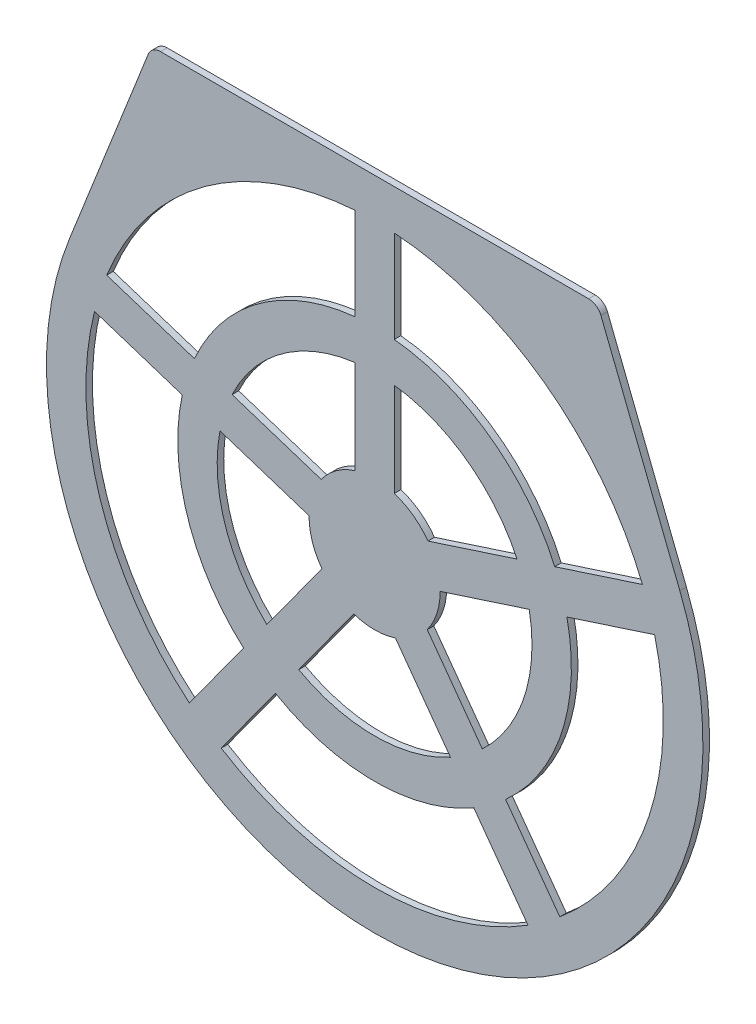
from build123d import *

# Parameters (mm, degrees)
BOSS_EXTRUDE1_DEPTH = 5


with BuildPart() as part:
    # Sketch1 → Boss-Extrude1 (new body)
    with BuildSketch(Plane.XY):
        with BuildLine():
            Line((-232.377693895, 91.946298682), (-172.366969932, 243.677851947))
            ThreePointArc((-172.366969932, 243.677851947), (-168.690205127, 248.269779909), (-163.067862176, 250))
            Line((-163.067862176, 250), (-0.1, 250))
            Line((-0.1, 250), (163.075862176, 250))
            ThreePointArc((163.075862176, 250), (168.693678089, 248.272855877), (172.370938455, 243.688028873))
            Line((172.370938455, 243.688028873), (232.476906979, 92.200721814))
            ThreePointArc((232.476906979, 92.200721814), (0.236829395, -249.999962555), (-232.377693895, 91.946298682))
        make_face()
        with BuildLine():
            Line((15.838692049, -47.319613631), (57.786513592, -105.055836805))
            ThreePointArc((57.786513592, -105.055836805), (0, -119.9), (-57.786513592, -105.055836805))
            Line((-57.786513592, -105.055836805), (-15.838692049, -47.319613631))
            ThreePointArc((-15.838692049, -47.319613631), (0, -49.9), (15.838692049, -47.319613631))
        make_face(mode=Mode.SUBTRACT)
        with BuildLine():
            Line((-40.10920188, -29.686056062), (-82.057023423, -87.422279237))
            ThreePointArc((-82.057023423, -87.422279237), (-114.031676304, -37.051137626), (-117.771052914, 22.494201374))
            Line((-117.771052914, 22.494201374), (-49.898051904, 0.440926504))
            ThreePointArc((-49.898051904, 0.440926504), (-47.457720163, -15.419948019), (-40.10920188, -29.686056062))
        make_face(mode=Mode.SUBTRACT)
        with BuildLine():
            Line((40.10920188, -29.686056062), (82.057023423, -87.422279237))
            ThreePointArc((82.057023423, -87.422279237), (114.031676304, -37.051137626), (117.771052914, 22.494201374))
            Line((117.771052914, 22.494201374), (49.898051904, 0.440926504))
            ThreePointArc((49.898051904, 0.440926504), (47.457720163, -15.419948019), (40.10920188, -29.686056062))
        make_face(mode=Mode.SUBTRACT)
        with BuildLine():
            Line((-137.21255284, 60.354994352), (-204.01494883, 82.060408564))
            ThreePointArc((-204.01494883, 82.060408564), (-129.253976979, 177.902837063), (-15, 219.387807318))
            Line((-15, 219.387807318), (-15, 149.147611446))
            ThreePointArc((-15, 149.147611446), (-88.109009319, 121.271647457), (-137.21255284, 60.354994352))
        make_face(mode=Mode.SUBTRACT)
        with BuildLine():
            Line((-146.483062671, 31.823298863), (-213.285458662, 53.528713076))
            ThreePointArc((-213.285458662, 53.528713076), (-209.137327933, -67.952837063), (-141.08817259, -168.671685695))
            Line((-141.08817259, -168.671685695), (-99.802021338, -111.846173546))
            ThreePointArc((-99.802021338, -111.846173546), (-142.563371793, -46.321647457), (-146.483062671, 31.823298863))
        make_face(mode=Mode.SUBTRACT)
        with BuildLine():
            Line((-75.531511507, -129.479731115), (-116.817662759, -186.305243264))
            ThreePointArc((-116.817662759, -186.305243264), (0, -219.9), (116.817662759, -186.305243264))
            Line((116.817662759, -186.305243264), (75.531511507, -129.479731115))
            ThreePointArc((75.531511507, -129.479731115), (0, -149.9), (-75.531511507, -129.479731115))
        make_face(mode=Mode.SUBTRACT)
        with BuildLine():
            Line((99.802021338, -111.846173546), (141.08817259, -168.671685695))
            ThreePointArc((141.08817259, -168.671685695), (209.137327933, -67.952837063), (213.285458662, 53.528713076))
            Line((213.285458662, 53.528713076), (146.483062671, 31.823298863))
            ThreePointArc((146.483062671, 31.823298863), (142.563371793, -46.321647457), (99.802021338, -111.846173546))
        make_face(mode=Mode.SUBTRACT)
        with BuildLine():
            Line((137.21255284, 60.354994352), (204.01494883, 82.060408564))
            ThreePointArc((204.01494883, 82.060408564), (129.253976979, 177.902837063), (15, 219.387807318))
            Line((15, 219.387807318), (15, 149.147611446))
            ThreePointArc((15, 149.147611446), (88.109009319, 121.271647457), (137.21255284, 60.354994352))
        make_face(mode=Mode.SUBTRACT)
        with BuildLine():
            Line((15, 47.592121197), (15, 118.958017805))
            ThreePointArc((15, 118.958017805), (70.47545175, 97.001137626), (108.500543083, 51.025896863))
            Line((108.500543083, 51.025896863), (40.627542073, 28.972621993))
            ThreePointArc((40.627542073, 28.972621993), (29.330484089, 40.369948019), (15, 47.592121197))
        make_face(mode=Mode.SUBTRACT)
        with BuildLine():
            Line((-40.627542073, 28.972621993), (-108.500543083, 51.025896863))
            ThreePointArc((-108.500543083, 51.025896863), (-70.47545175, 97.001137626), (-15, 118.958017805))
            Line((-15, 118.958017805), (-15, 47.592121197))
            ThreePointArc((-15, 47.592121197), (-29.330484089, 40.369948019), (-40.627542073, 28.972621993))
        make_face(mode=Mode.SUBTRACT)
    extrude(amount=BOSS_EXTRUDE1_DEPTH)


solid = part.part
